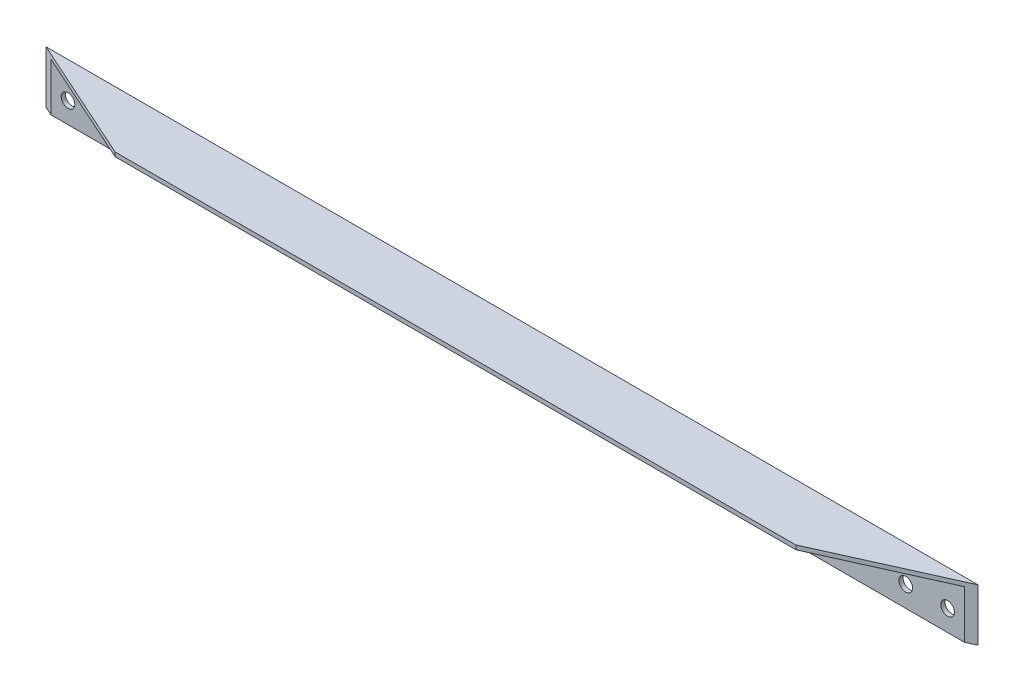
from build123d import *

# Parameters (mm, degrees)
SKETCH_1_W          = 1780
SKETCH_1_H          = 100
SKETCH_1_R          = 13
EXTRUDE_549_DEPTH   = 8
SKETCH_2_W          = 1780
SKETCH_2_H          = 8
EXTRUDE_1_DEPTH     = 100
CUT_EXTRUDE_1_DEPTH = 903.088687436


with BuildPart() as part:
    # 草图1 → Extrude 549 (new body)
    with BuildSketch(Plane.XY):
        with Locations((0, 50)):
            Rectangle(SKETCH_1_W, SKETCH_1_H)
        with Locations((840, 40)):
            Circle(SKETCH_1_R, mode=Mode.SUBTRACT)
        with Locations((760, 40)):
            Circle(SKETCH_1_R, mode=Mode.SUBTRACT)
        with Locations(Location((-840, 40, 0), (0, 0, 180))):
            Circle(SKETCH_1_R, mode=Mode.SUBTRACT)
        with Locations(Location((-760, 40, 0), (0, 0, 180))):
            Circle(SKETCH_1_R, mode=Mode.SUBTRACT)
    extrude(amount=EXTRUDE_549_DEPTH)

    # 草图2 → 凸台-拉伸1 (add)
    with BuildSketch(Plane.XY.offset(8)):
        with Locations((0, 96)):
            Rectangle(SKETCH_2_W, SKETCH_2_H)
    extrude(amount=EXTRUDE_1_DEPTH)

    # 草图3 → 切除-拉伸1 (cut, through all)
    with BuildSketch(Plane(origin=(0, 100, 0), x_dir=(-1, 0, 0), z_dir=(0, 1, 0))):
        Polygon((-650, 108), (-890, 0), (-890, 108), align=None)
        Polygon((890, 108), (650, 108), (890, 0), align=None)
    extrude(amount=-CUT_EXTRUDE_1_DEPTH, mode=Mode.SUBTRACT)


solid = part.part
